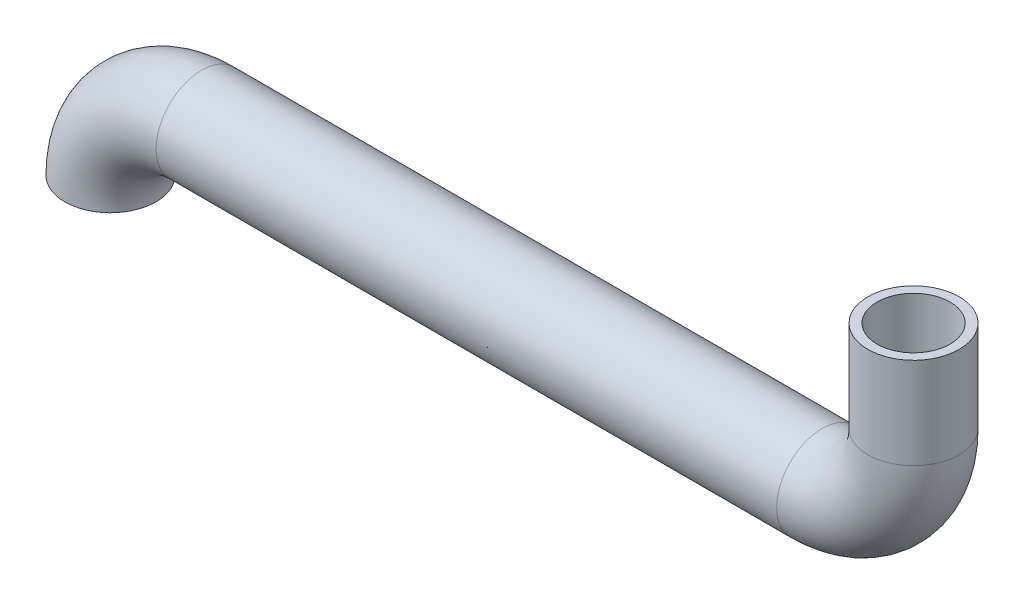
from build123d import *

# Parameters (mm, degrees)
SWEEP_1_PROFILE_R   = 5
SWEEP_1_PROFILE_R_2 = 4


with BuildPart() as part:
    # 扫描-薄件1: sweep along a path in 草图1
    with BuildLine(Plane.XY) as sweep_1_path:
        Line((78, 30), (78, 20))
        ThreePointArc((78, 20), (75.071067812, 12.928932188), (68, 10))
        Line((68, 10), (0, 10))
        ThreePointArc((0, 10), (-7.071067812, 7.071067812), (-10, 0))
    # 扫描-薄件1 profile (on start of the path) → 扫描-薄件1 (sweep)
    with BuildSketch(Plane(origin=(78, 30, 0), x_dir=(0, 0, -1), z_dir=(0, -1, 0))):
        Circle(SWEEP_1_PROFILE_R)
        Circle(SWEEP_1_PROFILE_R_2, mode=Mode.SUBTRACT)
    sweep(path=sweep_1_path.line)


solid = part.part
